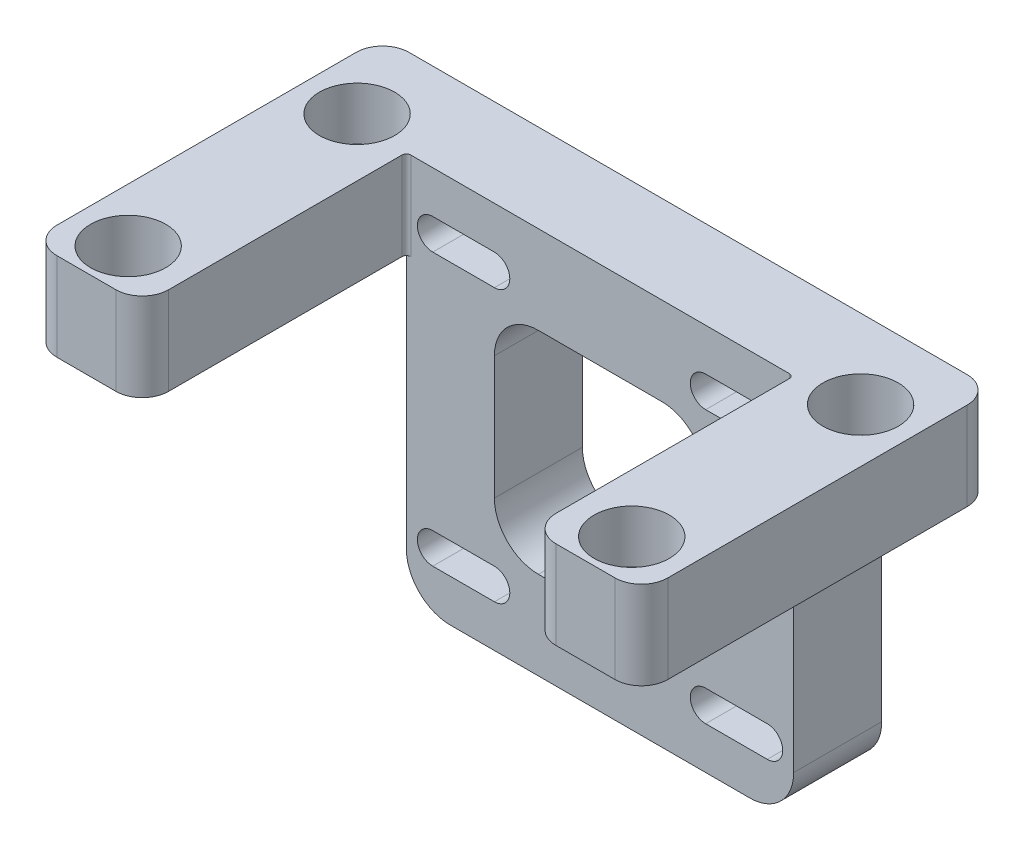
from build123d import *

# Parameters (mm, degrees)
SKETCH1_W           = 44
SKETCH1_H           = 44
BOSS_EXTRUDE1_DEPTH = 10
BOSS_EXTRUDE2_DEPTH = 12.7
SKETCH3_R           = 2.6
CUT_EXTRUDE1_DEPTH  = 63.929245983
SKETCH4_R           = 4.275
CUT_EXTRUDE2_DEPTH  = 66.177373375
FILLET1_R           = 3
FILLET2_R           = 5
FILLET3_R           = 0.5


with BuildPart() as part:
    # Sketch1 → Boss-Extrude1 (new body)
    with BuildSketch(Plane.XY):
        Rectangle(SKETCH1_W, SKETCH1_H)
        with BuildLine():
            Line((7, 12), (-7, 12))
            ThreePointArc((-7, 12), (-10.535533906, 10.535533906), (-12, 7))
            Line((-12, 7), (-12, -7))
            ThreePointArc((-12, -7), (-10.535533906, -10.535533906), (-7, -12))
            Line((-7, -12), (7, -12))
            ThreePointArc((7, -12), (10.535533906, -10.535533906), (12, -7))
            Line((12, -7), (12, 7))
            ThreePointArc((12, 7), (10.535533906, 10.535533906), (7, 12))
        make_face(mode=Mode.SUBTRACT)
        with BuildLine():
            Line((-19, 17.2), (-12, 17.2))
            ThreePointArc((-12, 17.2), (-10.25, 15.45), (-12, 13.7))
            Line((-12, 13.7), (-19, 13.7))
            ThreePointArc((-19, 13.7), (-20.75, 15.45), (-19, 17.2))
        make_face(mode=Mode.SUBTRACT)
        with BuildLine():
            Line((-19, -17.2), (-12, -17.2))
            ThreePointArc((-12, -17.2), (-10.25, -15.45), (-12, -13.7))
            Line((-12, -13.7), (-19, -13.7))
            ThreePointArc((-19, -13.7), (-20.75, -15.45), (-19, -17.2))
        make_face(mode=Mode.SUBTRACT)
        with BuildLine():
            Line((12, 17.2), (19, 17.2))
            ThreePointArc((19, 17.2), (20.75, 15.45), (19, 13.7))
            Line((19, 13.7), (12, 13.7))
            ThreePointArc((12, 13.7), (10.25, 15.45), (12, 17.2))
        make_face(mode=Mode.SUBTRACT)
        with BuildLine():
            Line((12, -13.7), (19, -13.7))
            ThreePointArc((19, -13.7), (20.75, -15.45), (19, -17.2))
            Line((19, -17.2), (12, -17.2))
            ThreePointArc((12, -17.2), (10.25, -15.45), (12, -13.7))
        make_face(mode=Mode.SUBTRACT)
    extrude(amount=BOSS_EXTRUDE1_DEPTH)

    # Sketch2 → Boss-Extrude2 (add)
    with BuildSketch(Plane(origin=(22, 0, 0), x_dir=(0, 0, -1), z_dir=(1, 0, 0))):
        Polygon((0, 12), (-40, 12), (-40, 16), (-40, 22), (-10, 22), (0, 22), align=None)
    boss_extrude2 = extrude(amount=BOSS_EXTRUDE2_DEPTH)

    # Sketch3 → Cut-Extrude1 (cut, through all)
    with BuildSketch(Plane.XZ.offset(-12)):
        with Locations((28.6, 35)):
            Circle(SKETCH3_R)
        with Locations((28.6, 9)):
            Circle(SKETCH3_R)
    cut_extrude1 = extrude(amount=-CUT_EXTRUDE1_DEPTH, mode=Mode.SUBTRACT)

    # Sketch4 → Cut-Extrude2 (cut, through all)
    with BuildSketch(Plane(origin=(0, 16, 0), x_dir=(-1, 0, 0), z_dir=(0, -1, 0))):
        with Locations(Location((-28.6, -9, 0), (0, 0, 180))):
            Circle(SKETCH4_R)
        with Locations(Location((-28.6, -35, 0), (0, 0, 180))):
            Circle(SKETCH4_R)
    cut_extrude2 = extrude(amount=-CUT_EXTRUDE2_DEPTH, mode=Mode.SUBTRACT)

    # Mirror1: Boss-Extrude2, Cut-Extrude1, Cut-Extrude2 across plane
    add(boss_extrude2.mirror(Plane(origin=(0, 0, 0), x_dir=(0, 0, 1), z_dir=(1, 0, 0))))
    add(cut_extrude1.mirror(Plane(origin=(0, 0, 0), x_dir=(0, 0, 1), z_dir=(1, 0, 0))), mode=Mode.SUBTRACT)
    add(cut_extrude2.mirror(Plane(origin=(0, 0, 0), x_dir=(0, 0, 1), z_dir=(1, 0, 0))), mode=Mode.SUBTRACT)

    # Fillet1
    fillet1_edges = [part.edges().sort_by_distance(p)[0] for p in [
        (34.7, 17, 0),
        (34.7, 17, 40),
        (-34.7, 17, 0),
        (-34.7, 17, 40),
        (-22, 17, 40),
        (22, 17, 40),
    ]]
    fillet(fillet1_edges, radius=FILLET1_R)

    # Fillet2
    fillet2_edges = [part.edges().sort_by_distance(p)[0] for p in [
        (22, -22, 5),
        (-22, -22, 5),
    ]]
    fillet(fillet2_edges, radius=FILLET2_R)

    # Fillet3
    fillet3_edges = [part.edges().sort_by_distance(p)[0] for p in [
        (-22, 17, 10),
        (22, 17, 10),
    ]]
    fillet(fillet3_edges, radius=FILLET3_R)


solid = part.part
